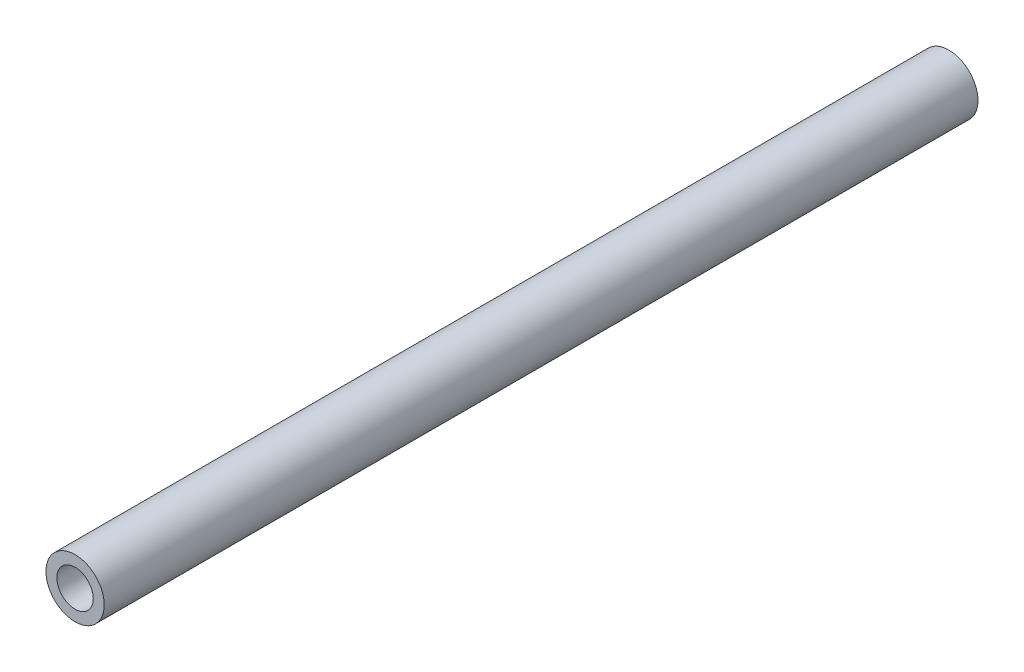
from build123d import *

# Parameters (mm, degrees)
SZKIC1_R                    = 8
SZKIC1_R_2                  = 4
DODANIE_WYCI_GNI_CIE1_DEPTH = 120
SZKIC2_R                    = 5
WYTNIJ_WYCI_GNI_CIE1_DEPTH  = 40
WYTNIJ_WYCI_GNI_CIE2_START  = -30
SZKIC3_R                    = 5
WYTNIJ_WYCI_GNI_CIE2_DEPTH  = 30


with BuildPart() as part:
    # Szkic1 → Dodanie-wyciągnięcie1 (new, symmetric)
    with BuildSketch(Plane.XY):
        Circle(SZKIC1_R)
        Circle(SZKIC1_R_2, mode=Mode.SUBTRACT)
    extrude(amount=DODANIE_WYCI_GNI_CIE1_DEPTH, both=True)

    # Szkic2 → Wytnij-wyciągnięcie1 (cut)
    with BuildSketch(Plane.XY.offset(120)):
        Circle(SZKIC2_R)
    extrude(amount=-WYTNIJ_WYCI_GNI_CIE1_DEPTH, mode=Mode.SUBTRACT)

    # Szkic3 → Wytnij-wyciągnięcie2 (cut)
    with BuildSketch(Plane(origin=(0, 0, -120), x_dir=(-1, 0, 0), z_dir=(0, 0, -1)).offset(WYTNIJ_WYCI_GNI_CIE2_START)):
        with Locations(Location((0, 0, 0), (0, 0, 180))):
            Circle(SZKIC3_R)
    extrude(amount=WYTNIJ_WYCI_GNI_CIE2_DEPTH, mode=Mode.SUBTRACT)


solid = part.part
